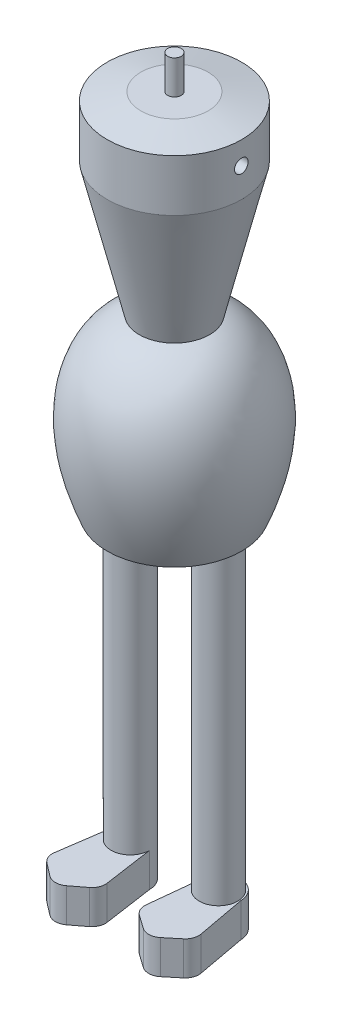
from build123d import *

# Parameters (mm, degrees)
SKETCH2_R               = 2.83366024
BOSS_EXTRUDE1_DEPTH     = 45
BOSS_EXTRUDE2_DEPTH     = 5
FILLET1_R               = 2
FILLET2_R               = 2
CUT_EXTRUDE2_DEPTH      = 115
CUT_EXTRUDE2_DEPTH_BACK = 96
SKETCH5_R               = 1
SKETCH7_R               = 1
BOSS_EXTRUDE3_DEPTH     = 5


with BuildPart() as part:
    # Sketch1 → Revolve7 (revolve)
    with BuildSketch(Plane.XY, mode=Mode.PRIVATE) as revolve7_sk:
        Polygon((0, 0), (0, 28.475188422), (-4.956233819, 28.475188422), (-9.912467638, 27.282021021), (-9.912467638, 19.643055135), (-5.183583994, 0), align=None)
        with BuildLine():
            Line((0, -25.281339493), (0, 0))
            Line((0, 0), (-5.183583994, 0))
            add(Edge.make_bspline(
                [(-5.183583994, 0), (-8.573978987, -1.188883935), (-14.492218072, -9.39255897), (-12.177190855, -19.84099189), (-9.91246763, -25.281339493)],
                knots=[0, 0, 0, 0, 0.353823056, 1, 1, 1, 1], degree=3))
            Line((-9.91246763, -25.281339493), (-4.956233811, -25.281339493))
            Line((-4.956233811, -25.281339493), (0, -25.281339493))
        make_face()
    revolve(revolve7_sk.sketch.rotate(Axis((0, 53.654641341, 0), (0, -1, 0)), 270), axis=Axis((0, 53.654641341, 0), (0, -1, 0)))

    # Sketch2 → Boss-Extrude1 (add)
    with BuildSketch(Plane.XZ.offset(25.281339493)):
        with Locations(Location((-6.497142555, 0, 0), (0, 0, 90))):
            Circle(SKETCH2_R)
        with Locations(Location((6.497142555, 0, 0), (0, 0, 90))):
            Circle(SKETCH2_R)
    extrude(amount=BOSS_EXTRUDE1_DEPTH)

    # Sketch3 → Boss-Extrude2 (add)
    with BuildSketch(Plane.XZ.offset(70.281339493)):
        with BuildLine():
            Line((-9.330802795, 0), (-10.560252354, 8.471200618))
            Line((-10.560252354, 8.471200618), (-6.497142555, 11.576029804))
            Line((-6.497142555, 11.576029804), (-2.434032757, 8.471200618))
            Line((-2.434032757, 8.471200618), (-3.663482316, 0))
            ThreePointArc((-3.663482316, 0), (-6.497142555, -2.83366024), (-9.330802795, 0))
        make_face()
        with BuildLine():
            Line((2.917036225, 8.367030218), (7.097906526, 11.311372086))
            Line((7.097906526, 11.311372086), (11.03709893, 8.050760378))
            Line((11.03709893, 8.050760378), (9.478884483, -0.366172191))
            ThreePointArc((9.478884483, -0.366172191), (6.537086047, -3.087400346), (3.815857893, -0.14560191))
            Line((3.815857893, -0.14560191), (2.917036225, 8.367030218))
        make_face()
    extrude(amount=BOSS_EXTRUDE2_DEPTH)

    # Fillet1
    fillet1_edges = [part.edges().sort_by_distance(p)[0] for p in [
        (-6.497142555, -72.781339493, 11.576029804),
        (7.097906526, -72.781339493, 11.311372086),
    ]]
    fillet(fillet1_edges, radius=FILLET1_R)

    # Fillet2
    fillet2_edges = [part.edges().sort_by_distance(p)[0] for p in [
        (-2.434032757, -72.781339493, 8.471200618),
        (-10.560252354, -72.781339493, 8.471200618),
        (11.03709893, -72.781339493, 8.050760378),
        (2.917036225, -72.781339493, 8.367030218),
    ]]
    fillet(fillet2_edges, radius=FILLET2_R)

    # Sketch5 → Cut-Extrude2 (cut, two sides: drawn at the far end of the back side and taken through both)
    with BuildSketch(Plane(origin=(0, 0, 0), x_dir=(0, 0, -1), z_dir=(1, 0, 0)).offset(-CUT_EXTRUDE2_DEPTH_BACK)):
        with Locations(Location((0, 23.936282306, 0), (0, 0, 180))):
            Circle(SKETCH5_R)
    extrude(amount=CUT_EXTRUDE2_DEPTH + CUT_EXTRUDE2_DEPTH_BACK, mode=Mode.SUBTRACT)

    # Sketch7 → Boss-Extrude3 (add)
    with BuildSketch(Plane(origin=(0, 28.475188422, 0), x_dir=(1, 0, 0), z_dir=(0, 1, 0))):
        with Locations(Location((0, 0, 0), (0, 0, 270))):
            Circle(SKETCH7_R)
    extrude(amount=BOSS_EXTRUDE3_DEPTH)


solid = part.part
